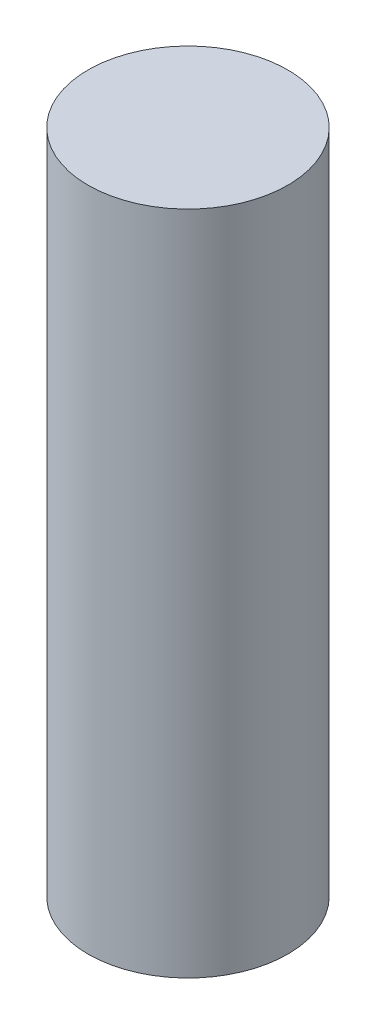
from build123d import *

# Parameters (mm, degrees)
SKETCH1_R           = 0.75
BOSS_EXTRUDE1_DEPTH = 5


with BuildPart() as part:
    # Sketch1 → Boss-Extrude1 (new body)
    with BuildSketch(Plane(origin=(0, 0, 0), x_dir=(1, 0, 0), z_dir=(0, 1, 0))):
        with Locations(Location((0, 0, 0), (0, 0, 270))):
            Circle(SKETCH1_R)
    extrude(amount=BOSS_EXTRUDE1_DEPTH)


solid = part.part
